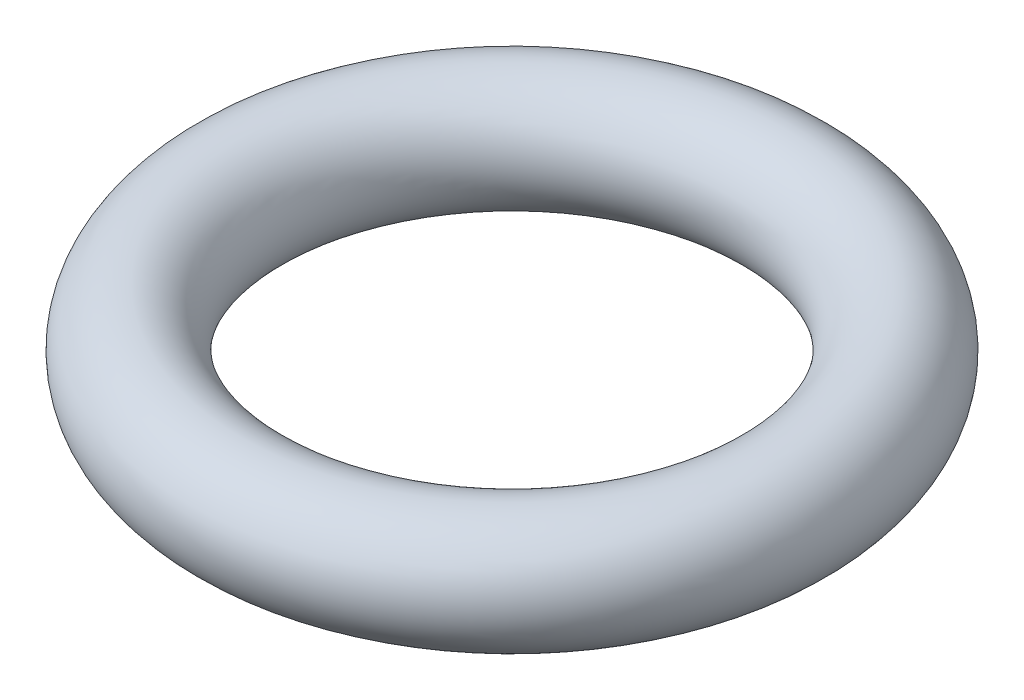
from build123d import *

# Parameters (mm, degrees)
SKETCH1_R = 2.819668528


with BuildPart() as part:
    # Sketch1 → Revolve1 (revolve)
    with BuildSketch(Plane.XY, mode=Mode.PRIVATE) as revolve1_sk:
        with Locations((13.121948499, 0)):
            Circle(SKETCH1_R)
    revolve(revolve1_sk.sketch.rotate(Axis((0, -5.311792147, 0), (0, 1, 0)), 90), axis=Axis((0, -5.311792147, 0), (0, 1, 0)))


solid = part.part
